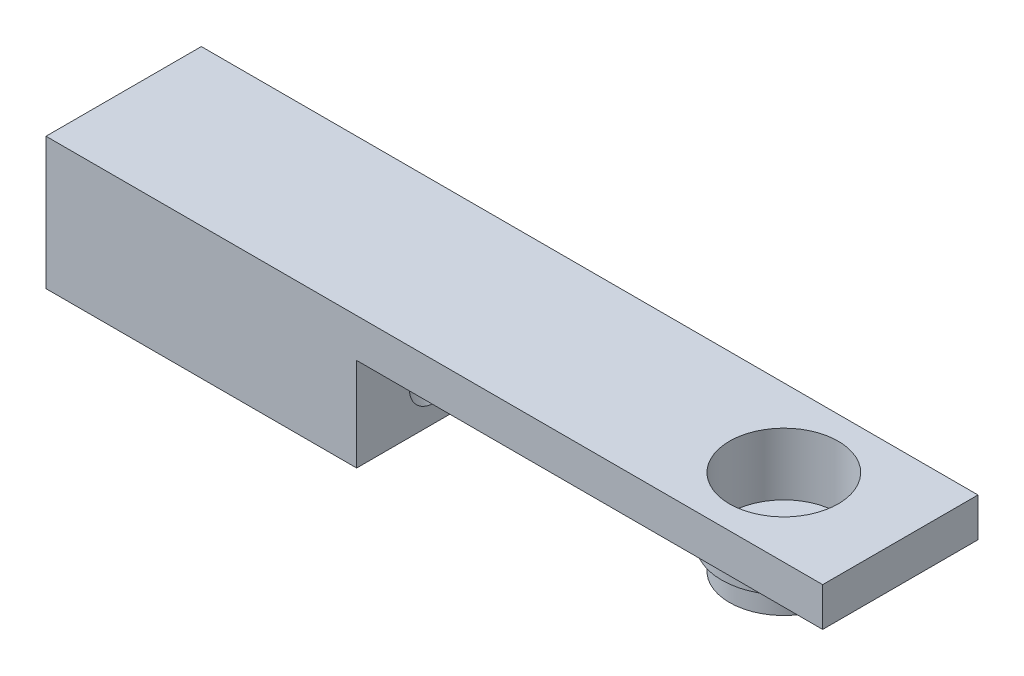
from build123d import *

# Parameters (mm, degrees)
SKETCH_1_W          = 20
SKETCH_1_H          = 17
EXTRUDE_1_DEPTH     = 40
SKETCH_2_W          = 20
SKETCH_2_H          = 5
EXTRUDE_2_DEPTH     = 60
SKETCH_3_R          = 8
EXTRUDE_3_DEPTH     = 3
SKETCH_4_R          = 7
EXTRUDE_4_DEPTH     = 3
SKETCH_16_R         = 7
CUT_EXTRUDE_1_DEPTH = 8


with BuildPart() as part:
    # Эскиз1 → Бобышка-Вытянуть1 (new body)
    with BuildSketch(Plane(origin=(0, 0, 0), x_dir=(0, 0, -1), z_dir=(1, 0, 0))):
        with Locations((-27.72412662, 10.853987982)):
            Rectangle(SKETCH_1_W, SKETCH_1_H)
    extrude(amount=EXTRUDE_1_DEPTH)

    # Эскиз2 → Бобышка-Вытянуть2 (add)
    with BuildSketch(Plane(origin=(40, 0, 0), x_dir=(0, 0, -1), z_dir=(1, 0, 0))):
        with Locations((-27.72412662, 16.853987982)):
            Rectangle(SKETCH_2_W, SKETCH_2_H)
    extrude(amount=EXTRUDE_2_DEPTH)

    # Эскиз3 → Бобышка-Вытянуть3 (add)
    with BuildSketch(Plane.XZ.offset(-14.353987982)):
        with Locations(Location((85, 27.72412662, 0), (0, 0, 90))):
            Circle(SKETCH_3_R)
    extrude(amount=EXTRUDE_3_DEPTH)

    # Эскиз4 → Бобышка-Вытянуть4 (add)
    with BuildSketch(Plane.XZ.offset(-11.353987982)):
        with Locations(Location((85, 27.72412662, 0), (0, 0, 270))):
            Circle(SKETCH_4_R)
    extrude(amount=EXTRUDE_4_DEPTH)

    # Эскиз15 → Зенковка для винта с полупотайной головкой M32 (revolve, cut)
    with BuildSketch(Plane(origin=(40, 7.784111953, 27.791024889), x_dir=(0, 0, -1), z_dir=(0, 1, 0))):
        Polygon((0, 0), (0, 40), (1.7, 40), (1.7, 1.45), (3.15, 0), align=None)
    revolve(axis=Axis((46.35, 7.784111953, 27.791024889), (-1, 0, 0)), mode=Mode.SUBTRACT)

    # Эскиз16 → Вырез-Вытянуть1 (cut)
    with BuildSketch(Plane(origin=(0, 19.353987982, 0), x_dir=(1, 0, 0), z_dir=(0, 1, 0))):
        with Locations(Location((85, -27.72412662, 0), (0, 0, 270))):
            Circle(SKETCH_16_R)
    extrude(amount=-CUT_EXTRUDE_1_DEPTH, mode=Mode.SUBTRACT)


with BuildPart() as cut_extrude_1_piece_1:
    # of the separate pieces the step leaves, piece 1, a body of its own (cut_extrude_1_pieces)
    add(part.part.solids().sort_by_distance((0, 2.353987982, 37.72412662))[0])


with BuildPart() as cut_extrude_1_piece_2:
    # of the separate pieces the step leaves, piece 2, a body of its own (cut_extrude_1_pieces)
    add(part.part.solids().sort_by_distance((85, 8.353987982, 20.72412662))[0])


solid = Compound([cut_extrude_1_piece_1.part, cut_extrude_1_piece_2.part])
